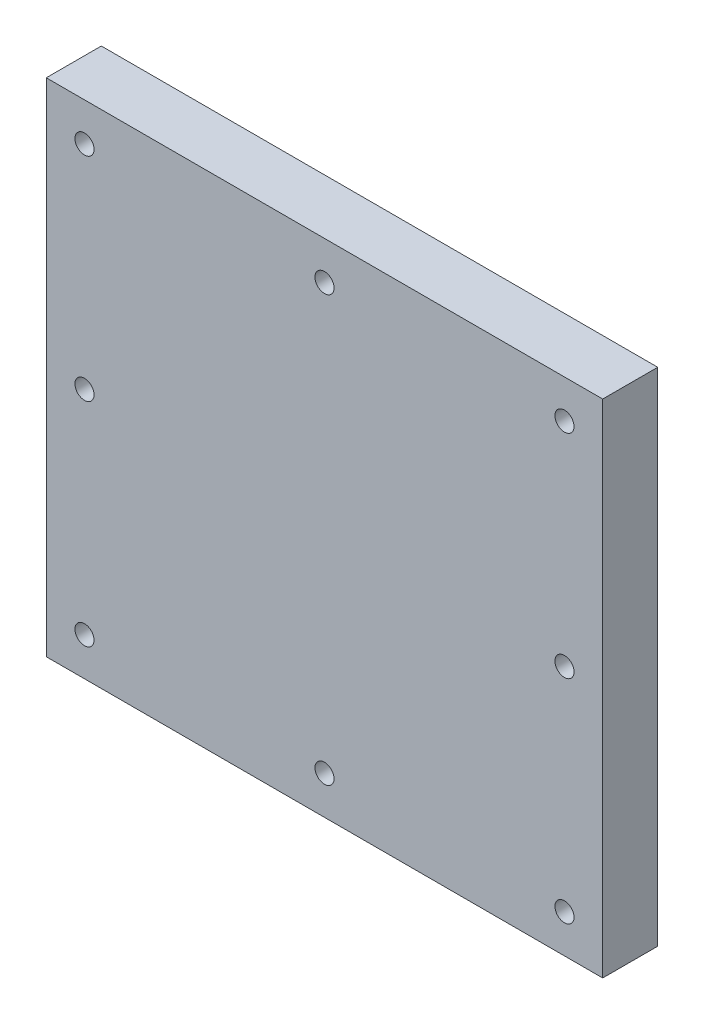
from build123d import *

# Parameters (mm, degrees)
SKETCH1_W           = 184.912
SKETCH1_H           = 166.624
BOSS_EXTRUDE1_DEPTH = 18.288
SKETCH3_R           = 3.175
CUT_EXTRUDE2_DEPTH  = 25.4


with BuildPart() as part:
    # Sketch1 → Boss-Extrude1 (new body)
    with BuildSketch(Plane.XY):
        with Locations((347.100886228, 150.91554491)):
            Rectangle(SKETCH1_W, SKETCH1_H)
    extrude(amount=BOSS_EXTRUDE1_DEPTH)

    # Sketch3 → Cut-Extrude2 (cut)
    with BuildSketch(Plane.XY.offset(18.288)):
        with Locations((267.344886228, 221.52754491)):
            Circle(SKETCH3_R)
        with Locations((347.100886228, 221.52754491)):
            Circle(SKETCH3_R)
        with Locations((426.856886228, 221.52754491)):
            Circle(SKETCH3_R)
        with Locations((426.856886228, 150.91554491)):
            Circle(SKETCH3_R)
        with Locations((267.344886228, 150.91554491)):
            Circle(SKETCH3_R)
        with Locations((347.100886228, 80.30354491)):
            Circle(SKETCH3_R)
        with Locations((426.856886228, 80.30354491)):
            Circle(SKETCH3_R)
        with Locations((267.344886228, 80.30354491)):
            Circle(SKETCH3_R)
    extrude(amount=-CUT_EXTRUDE2_DEPTH, mode=Mode.SUBTRACT)


solid = part.part
